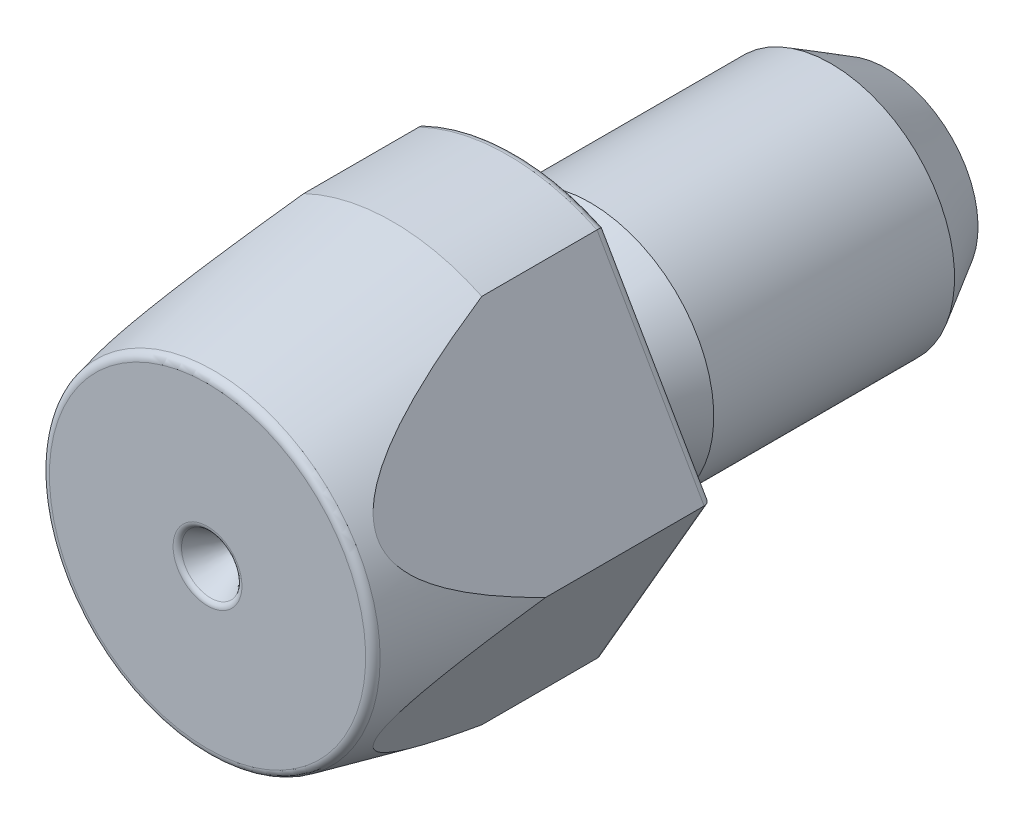
from build123d import *

# Parameters (mm, degrees)
CUT_EXTRUDE4_DEPTH = 23.891046285
FILLET1_R          = 0.4
FILLET2_R          = 0.4
FILLET3_R          = 0.3


with BuildPart() as part:
    # Sketch3 → Revolve2 (revolve)
    with BuildSketch(Plane(origin=(0, 0, 0), x_dir=(0, 0, -1), z_dir=(1, 0, 0))):
        Polygon((-16.5, 0), (-16.5, 8.004748036), (-7.5, 10), (-1.5, 10), (-1.5, 6), (16.5, 6), (16.5, 0), align=None)
    revolve(axis=Axis((0, 0, -16.5), (0, 0, 1)))

    # Sketch14 → Cut-Extrude4 (cut, through all)
    with BuildSketch(Plane(origin=(0, 0, 1.5), x_dir=(-1, 0, 0), z_dir=(0, 0, -1))):
        Polygon((-9.531762002, 0), (-4.326626661, -9.01555887), (0.878508679, -18.03111774), (-12.531762002, -18.03111774), (-12.531762002, 18.03111774), (0.878508679, 18.03111774), (-4.326626661, 9.01555887), align=None)
    cut_extrude4 = extrude(amount=-CUT_EXTRUDE4_DEPTH, mode=Mode.SUBTRACT)

    # Mirror1: Cut-Extrude4 across plane
    add(cut_extrude4.mirror(Plane(origin=(0, 0, 0), x_dir=(0, 0, 1), z_dir=(1, 0, 0))), mode=Mode.SUBTRACT)

    # Sketch16 → Cut-Revolve1 (revolve, cut)
    with BuildSketch(Plane(origin=(0, 0, 0), x_dir=(0, 0, -1), z_dir=(1, 0, 0)), mode=Mode.PRIVATE) as cut_revolve1_sk:
        with BuildLine():
            Line((-1.5, 6), (-1.716506351, 5.625))
            ThreePointArc((-1.716506351, 5.625), (-1.716506351, 5.375), (-1.5, 5.25))
            Line((-1.5, 5.25), (-0.225098536, 5.25))
            ThreePointArc((-0.225098536, 5.25), (0.035373731, 5.27278837), (0.287931679, 5.340461069))
            Line((0.287931679, 5.340461069), (2.1, 6))
            Line((2.1, 6), (-1.5, 6))
        make_face()
        Polygon((13.8, 6), (16.5, 4.441154273), (16.5, 6), align=None)
    revolve(cut_revolve1_sk.sketch.rotate(Axis((0, 0, 16.5), (0, 0, -1)), 180), axis=Axis((0, 0, 16.5), (0, 0, -1)), mode=Mode.SUBTRACT)

    # Cut-Extrude2 cone 1 section (through the dimple's axis) → Cut-Extrude2 (revolve, cut)
    with BuildSketch(Plane(origin=(0, 0, 16.5), x_dir=(0, -1, 0), z_dir=(1, 0, 0))):
        Polygon((0, 0), (1.5, 0), (0, 2.598076211), align=None)
    revolve(axis=Axis((0, 0, 16.5), (0, 0, -1)), mode=Mode.SUBTRACT)

    # Cut-Extrude5 cone 1 section (through the dimple's axis) → Cut-Extrude5 (revolve, cut)
    with BuildSketch(Plane(origin=(0, 0, -16.5), x_dir=(0, 1, 0), z_dir=(1, 0, 0))):
        Polygon((0, 0), (1.5, 0), (0, 2.598076211), align=None)
    revolve(axis=Axis((0, 0, -16.5), (0, 0, 1)), mode=Mode.SUBTRACT)

    # Fillet1
    fillet1_edges = [part.edges().sort_by_distance(p)[0] for p in [
        (0, -8.004748036, 16.5),
    ]]
    fillet(fillet1_edges, radius=FILLET1_R)

    # Fillet2
    fillet2_edges = [part.edges().sort_by_distance(p)[0] for p in [
        (0, -10, 1.5),
        (6.929194331, -4.507779435, 1.5),
        (6.929194331, 4.507779435, 1.5),
        (0, 10, 1.5),
        (-6.929194331, -4.507779435, 1.5),
        (-6.929194331, 4.507779435, 1.5),
    ]]
    fillet(fillet2_edges, radius=FILLET2_R)

    # Fillet3
    fillet3_edges = [part.edges().sort_by_distance(p)[0] for p in [
        (0, 1.5, 16.5),
        (0, -1.5, -16.5),
    ]]
    fillet(fillet3_edges, radius=FILLET3_R)


solid = part.part
